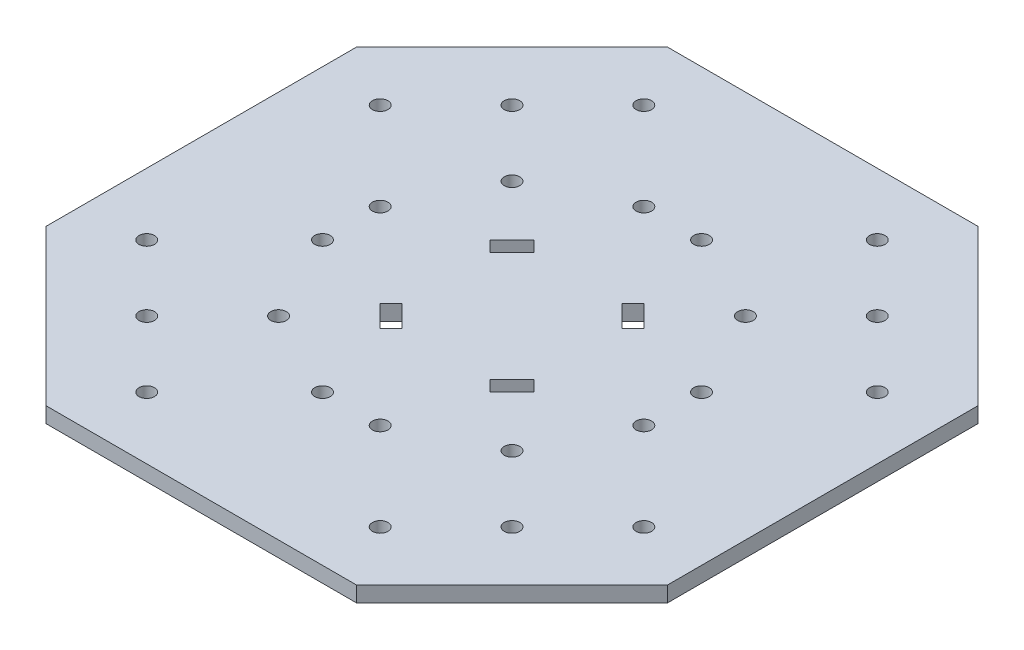
from build123d import *

# Parameters (mm, degrees)
SKETCH1_W           = 200
SKETCH1_H           = 200
BOSS_EXTRUDE1_DEPTH = 5
SKETCH3_R           = 2.5
CUT_EXTRUDE2_DEPTH  = 5
CUT_EXTRUDE4_DEPTH  = 200
CHAMFER1_SIZE       = 50
SKETCH5_R           = 2.5
CUT_EXTRUDE5_DEPTH  = 10


with BuildPart() as part:
    # Sketch1 → Boss-Extrude1 (new body)
    with BuildSketch(Plane(origin=(0, 0, 0), x_dir=(1, 0, 0), z_dir=(0, 1, 0))):
        with Locations((100, 100)):
            Rectangle(SKETCH1_W, SKETCH1_H)
    extrude(amount=BOSS_EXTRUDE1_DEPTH)

    # Sketch3 → Cut-Extrude2 (cut)
    with BuildSketch(Plane(origin=(0, 5, 0), x_dir=(1, 0, 0), z_dir=(0, 1, 0))):
        with Locations(Location((180, 62.426406871, 0), (0, 0, 270))):
            Circle(SKETCH3_R)
        with Locations(Location((90.710678119, 48.284271247, 0), (0, 0, 90))):
            Circle(SKETCH3_R)
        with Locations(Location((109.289321881, 48.284271247, 0), (0, 0, 270))):
            Circle(SKETCH3_R)
        with Locations(Location((62.426406871, 20, 0), (0, 0, 90))):
            Circle(SKETCH3_R)
        with Locations(Location((137.573593129, 20, 0), (0, 0, 270))):
            Circle(SKETCH3_R)
        with Locations(Location((20, 62.426406871, 0), (0, 0, 270))):
            Circle(SKETCH3_R)
        with Locations(Location((48.284271247, 90.710678119, 0), (0, 0, 270))):
            Circle(SKETCH3_R)
        with Locations(Location((20, 137.573593129, 0), (0, 0, 90))):
            Circle(SKETCH3_R)
        with Locations(Location((48.284271247, 109.289321881, 0), (0, 0, 90))):
            Circle(SKETCH3_R)
        with Locations(Location((62.426406871, 180, 0), (0, 0, 270))):
            Circle(SKETCH3_R)
        with Locations(Location((90.710678119, 151.715728753, 0), (0, 0, 270))):
            Circle(SKETCH3_R)
        with Locations(Location((109.289321881, 151.715728753, 0), (0, 0, 90))):
            Circle(SKETCH3_R)
        with Locations(Location((137.573593129, 180, 0), (0, 0, 90))):
            Circle(SKETCH3_R)
        with Locations(Location((180, 137.573593129, 0), (0, 0, 270))):
            Circle(SKETCH3_R)
        with Locations(Location((151.715728753, 109.289321881, 0), (0, 0, 270))):
            Circle(SKETCH3_R)
        with Locations(Location((151.715728753, 90.710678119, 0), (0, 0, 90))):
            Circle(SKETCH3_R)
    extrude(amount=-CUT_EXTRUDE2_DEPTH, mode=Mode.SUBTRACT)

    # Sketch4 → Cut-Extrude4 (cut)
    with BuildSketch(Plane(origin=(0, 5, 0), x_dir=(1, 0, 0), z_dir=(0, 1, 0))):
        Polygon((114.142135624, 121.213203436), (121.213203436, 114.142135624), (124.748737342, 117.67766953), (117.67766953, 124.748737342), align=None)
        Polygon((121.213203436, 85.857864376), (114.142135624, 78.786796564), (117.67766953, 75.251262658), (124.748737342, 82.32233047), align=None)
        Polygon((82.32233047, 75.251262658), (85.857864376, 78.786796564), (78.786796564, 85.857864376), (75.251262658, 82.32233047), align=None)
        Polygon((75.251262658, 117.67766953), (78.786796564, 114.142135624), (85.857864376, 121.213203436), (82.32233047, 124.748737342), align=None)
    extrude(amount=-CUT_EXTRUDE4_DEPTH, mode=Mode.SUBTRACT)

    # Chamfer1
    chamfer1_edges = [part.edges().sort_by_distance(p)[0] for p in [
        (0, 2.5, -200),
        (200, 2.5, -200),
        (200, 2.5, 0),
        (0, 2.5, 0),
    ]]
    chamfer(chamfer1_edges, length=CHAMFER1_SIZE)

    # Sketch5 → Cut-Extrude5 (cut)
    with BuildSketch(Plane(origin=(0, 5, 0), x_dir=(1, 0, 0), z_dir=(0, 1, 0))):
        with Locations(Location((41.213203436, 41.213203436, 0), (0, 0, 270))):
            Circle(SKETCH5_R)
        with Locations(Location((62.426406871, 137.573593129, 0), (0, 0, 270))):
            Circle(SKETCH5_R)
        with Locations(Location((41.213203436, 158.786796564, 0), (0, 0, 270))):
            Circle(SKETCH5_R)
        with Locations(Location((137.573593129, 137.573593129, 0), (0, 0, 270))):
            Circle(SKETCH5_R)
        with Locations(Location((158.786796564, 158.786796564, 0), (0, 0, 270))):
            Circle(SKETCH5_R)
        with Locations(Location((137.573593129, 62.426406871, 0), (0, 0, 270))):
            Circle(SKETCH5_R)
        with Locations(Location((158.786796564, 41.213203436, 0), (0, 0, 270))):
            Circle(SKETCH5_R)
        with Locations(Location((62.426406871, 62.426406871, 0), (0, 0, 270))):
            Circle(SKETCH5_R)
    extrude(amount=-CUT_EXTRUDE5_DEPTH, mode=Mode.SUBTRACT)


solid = part.part
